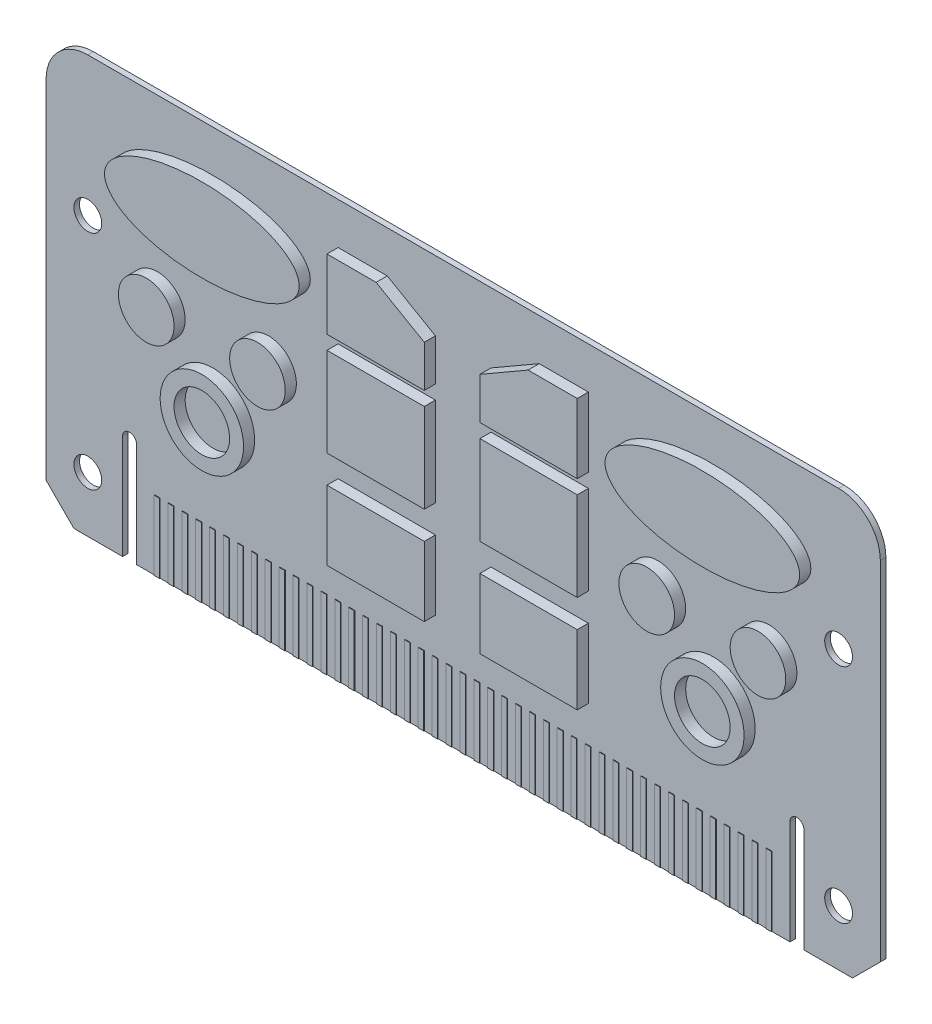
from build123d import *

# Parameters (mm, degrees)
SKETCH1_W              = 300
SKETCH1_H              = 150
PCB_BASE_DEPTH         = 1
SLOTS_REACH            = 337.416
SKETCH2_R              = 10
SKETCH2_R_2            = 15
SKETCH2_RX             = 35
SKETCH2_RY             = 15
SKETCH2_W              = 35
SKETCH2_H              = 32
SKETCH2_H_2            = 25
SURFACE_CHIPS_DEPTH    = 5
SKETCH4_W              = 2
SKETCH4_H              = 25
CONTACTS_DEPTH         = 0.2
F_10_0MM_DOWEL_HOLE1_D = 10
CHAMFER1_SIZE          = 10
FILLET1_R              = 15


with BuildPart() as part:
    # Sketch1 → PCB Base (new, symmetric)
    with BuildSketch(Plane.XY):
        with Locations((-150, 75)):
            Rectangle(SKETCH1_W, SKETCH1_H)
    extrude(amount=PCB_BASE_DEPTH, both=True)

    # Sketch3 → Slots (cut, up to next)
    with BuildSketch(Plane.XY.offset(1), mode=Mode.PRIVATE) as slots_sk1:
        with BuildLine():
            Line((-272.5, -37.5), (-272.5, 37.5))
            ThreePointArc((-272.5, 37.5), (-270, 40), (-267.5, 37.5))
            Line((-267.5, 37.5), (-267.5, -37.5))
            ThreePointArc((-267.5, -37.5), (-270, -40), (-272.5, -37.5))
        make_face()
    slots_tool1 = extrude(slots_sk1.sketch, amount=-SLOTS_REACH, mode=Mode.PRIVATE) & part.part
    # Sketch3 → Slots (cut, up to next)
    with BuildSketch(Plane.XY.offset(1), mode=Mode.PRIVATE) as slots_sk2:
        with BuildLine():
            Line((-27.5, -37.5), (-27.5, 37.5))
            ThreePointArc((-27.5, 37.5), (-30, 40), (-32.5, 37.5))
            Line((-32.5, 37.5), (-32.5, -37.5))
            ThreePointArc((-32.5, -37.5), (-30, -40), (-27.5, -37.5))
        make_face()
    slots_tool2 = extrude(slots_sk2.sketch, amount=-SLOTS_REACH, mode=Mode.PRIVATE) & part.part
    add(slots_tool1.solids().sort_by_distance((-270, 0, 1))[0], mode=Mode.SUBTRACT)
    add(slots_tool2.solids().sort_by_distance((-30, 0, 1))[0], mode=Mode.SUBTRACT)

    # Sketch2 → Surface Chips (add)
    # profile 1 of 14: a face of its own
    with BuildSketch(Plane.XY):
        with Locations(Location((-260, 85, 0), (0, 0, 180))):
            Circle(SKETCH2_R)
    # profile 2 of 14: a face of its own
    with BuildSketch(Plane.XY):
        with Locations(Location((-220, 85, 0), (0, 0, 180))):
            Circle(SKETCH2_R)
    # profile 3 of 14: a face of its own
    with BuildSketch(Plane.XY):
        with Locations(Location((-240, 60, 0), (0, 0, 180))):
            Circle(SKETCH2_R_2)
        with Locations(Location((-240, 60, 0), (0, 0, 180))):
            Circle(SKETCH2_R, mode=Mode.SUBTRACT)
    # profile 4 of 14: a face of its own
    with BuildSketch(Plane.XY):
        with Locations(Location((-60, 60, 0), (0, 0, 180))):
            Circle(SKETCH2_R_2)
        with Locations(Location((-60, 60, 0), (0, 0, 180))):
            Circle(SKETCH2_R, mode=Mode.SUBTRACT)
    # profile 5 of 14: a face of its own
    with BuildSketch(Plane.XY):
        with Locations(Location((-80, 85, 0), (0, 0, 180))):
            Circle(SKETCH2_R)
    # profile 6 of 14: a face of its own
    with BuildSketch(Plane.XY):
        with Locations(Location((-40, 85, 0), (0, 0, 180))):
            Circle(SKETCH2_R)
    # profile 7 of 14: a face of its own
    with BuildSketch(Plane.XY):
        with Locations(Location((-240, 120), (0, 0, 180))):
            Ellipse(SKETCH2_RX, SKETCH2_RY)
    # profile 8 of 14: a face of its own
    with BuildSketch(Plane.XY):
        with Locations(Location((-60, 120), (0, 0, 180))):
            Ellipse(SKETCH2_RX, SKETCH2_RY)
    # profile 9 of 14: a face of its own
    with BuildSketch(Plane.XY):
        Polygon((-177.320508076, 135), (-160, 125), (-160, 110), (-195, 110), (-195, 135), align=None)
    # profile 10 of 14: a face of its own
    with BuildSketch(Plane.XY):
        with Locations((-177.5, 89)):
            Rectangle(SKETCH2_W, SKETCH2_H)
    # profile 11 of 14: a face of its own
    with BuildSketch(Plane.XY):
        with Locations((-177.5, 50.5)):
            Rectangle(SKETCH2_W, SKETCH2_H_2)
    # profile 12 of 14: a face of its own
    with BuildSketch(Plane.XY):
        with Locations((-122.5, 50.5)):
            Rectangle(SKETCH2_W, SKETCH2_H_2)
    # profile 13 of 14: a face of its own
    with BuildSketch(Plane.XY):
        with Locations((-122.5, 89)):
            Rectangle(SKETCH2_W, SKETCH2_H)
    # profile 14 of 14: a face of its own
    with BuildSketch(Plane.XY):
        Polygon((-140, 125), (-140, 110), (-105, 110), (-105, 135), (-122.679491924, 135), align=None)
    surface_chips = extrude(amount=SURFACE_CHIPS_DEPTH)

    # Mirror Chips: Surface Chips across plane
    add(surface_chips.mirror(Plane.XY))

    # Sketch4 → Contacts (add)
    with BuildSketch(Plane.XY.offset(1)):
        with Locations((-260, 12.5)):
            Rectangle(SKETCH4_W, SKETCH4_H)
        with Locations((-255, 12.5)):
            Rectangle(SKETCH4_W, SKETCH4_H)
        with Locations((-250, 12.5)):
            Rectangle(SKETCH4_W, SKETCH4_H)
        with Locations((-245, 12.5)):
            Rectangle(SKETCH4_W, SKETCH4_H)
        with Locations((-240, 12.5)):
            Rectangle(SKETCH4_W, SKETCH4_H)
        with Locations((-235, 12.5)):
            Rectangle(SKETCH4_W, SKETCH4_H)
        with Locations((-230, 12.5)):
            Rectangle(SKETCH4_W, SKETCH4_H)
        with Locations((-225, 12.5)):
            Rectangle(SKETCH4_W, SKETCH4_H)
        with Locations((-220, 12.5)):
            Rectangle(SKETCH4_W, SKETCH4_H)
        with Locations((-215, 12.5)):
            Rectangle(SKETCH4_W, SKETCH4_H)
        with Locations((-210, 12.5)):
            Rectangle(SKETCH4_W, SKETCH4_H)
        with Locations((-205, 12.5)):
            Rectangle(SKETCH4_W, SKETCH4_H)
        with Locations((-200, 12.5)):
            Rectangle(SKETCH4_W, SKETCH4_H)
        with Locations((-195, 12.5)):
            Rectangle(SKETCH4_W, SKETCH4_H)
        with Locations((-190, 12.5)):
            Rectangle(SKETCH4_W, SKETCH4_H)
        with Locations((-185, 12.5)):
            Rectangle(SKETCH4_W, SKETCH4_H)
        with Locations((-180, 12.5)):
            Rectangle(SKETCH4_W, SKETCH4_H)
        with Locations((-175, 12.5)):
            Rectangle(SKETCH4_W, SKETCH4_H)
        with Locations((-170, 12.5)):
            Rectangle(SKETCH4_W, SKETCH4_H)
        with Locations((-165, 12.5)):
            Rectangle(SKETCH4_W, SKETCH4_H)
        with Locations((-160, 12.5)):
            Rectangle(SKETCH4_W, SKETCH4_H)
        with Locations((-155, 12.5)):
            Rectangle(SKETCH4_W, SKETCH4_H)
        with Locations((-150, 12.5)):
            Rectangle(SKETCH4_W, SKETCH4_H)
        with Locations((-145, 12.5)):
            Rectangle(SKETCH4_W, SKETCH4_H)
        with Locations((-140, 12.5)):
            Rectangle(SKETCH4_W, SKETCH4_H)
        with Locations((-135, 12.5)):
            Rectangle(SKETCH4_W, SKETCH4_H)
        with Locations((-130, 12.5)):
            Rectangle(SKETCH4_W, SKETCH4_H)
        with Locations((-125, 12.5)):
            Rectangle(SKETCH4_W, SKETCH4_H)
        with Locations((-120, 12.5)):
            Rectangle(SKETCH4_W, SKETCH4_H)
        with Locations((-115, 12.5)):
            Rectangle(SKETCH4_W, SKETCH4_H)
        with Locations((-110, 12.5)):
            Rectangle(SKETCH4_W, SKETCH4_H)
        with Locations((-105, 12.5)):
            Rectangle(SKETCH4_W, SKETCH4_H)
        with Locations((-100, 12.5)):
            Rectangle(SKETCH4_W, SKETCH4_H)
        with Locations((-95, 12.5)):
            Rectangle(SKETCH4_W, SKETCH4_H)
        with Locations((-90, 12.5)):
            Rectangle(SKETCH4_W, SKETCH4_H)
        with Locations((-85, 12.5)):
            Rectangle(SKETCH4_W, SKETCH4_H)
        with Locations((-80, 12.5)):
            Rectangle(SKETCH4_W, SKETCH4_H)
        with Locations((-75, 12.5)):
            Rectangle(SKETCH4_W, SKETCH4_H)
        with Locations((-70, 12.5)):
            Rectangle(SKETCH4_W, SKETCH4_H)
        with Locations((-65, 12.5)):
            Rectangle(SKETCH4_W, SKETCH4_H)
        with Locations((-60, 12.5)):
            Rectangle(SKETCH4_W, SKETCH4_H)
        with Locations((-55, 12.5)):
            Rectangle(SKETCH4_W, SKETCH4_H)
        with Locations((-50, 12.5)):
            Rectangle(SKETCH4_W, SKETCH4_H)
        with Locations((-45, 12.5)):
            Rectangle(SKETCH4_W, SKETCH4_H)
        with Locations((-40, 12.5)):
            Rectangle(SKETCH4_W, SKETCH4_H)
    extrude(amount=CONTACTS_DEPTH)

    # Ø10.0mm Dowel Hole1 (through all)
    with Locations(Plane.XY.offset(1)):
        with Locations((-285, 20), (-15, 20), (-285, 100), (-15, 100)):
            Hole(F_10_0MM_DOWEL_HOLE1_D / 2)

    # Chamfer1
    chamfer1_edges = [part.edges().sort_by_distance(p)[0] for p in [
        (0, 0, 0),
        (-300, 0, 0),
    ]]
    chamfer(chamfer1_edges, length=CHAMFER1_SIZE)

    # Fillet1
    fillet1_edges = [part.edges().sort_by_distance(p)[0] for p in [
        (-300, 150, 0),
        (0, 150, 0),
    ]]
    fillet(fillet1_edges, radius=FILLET1_R)


solid = part.part
